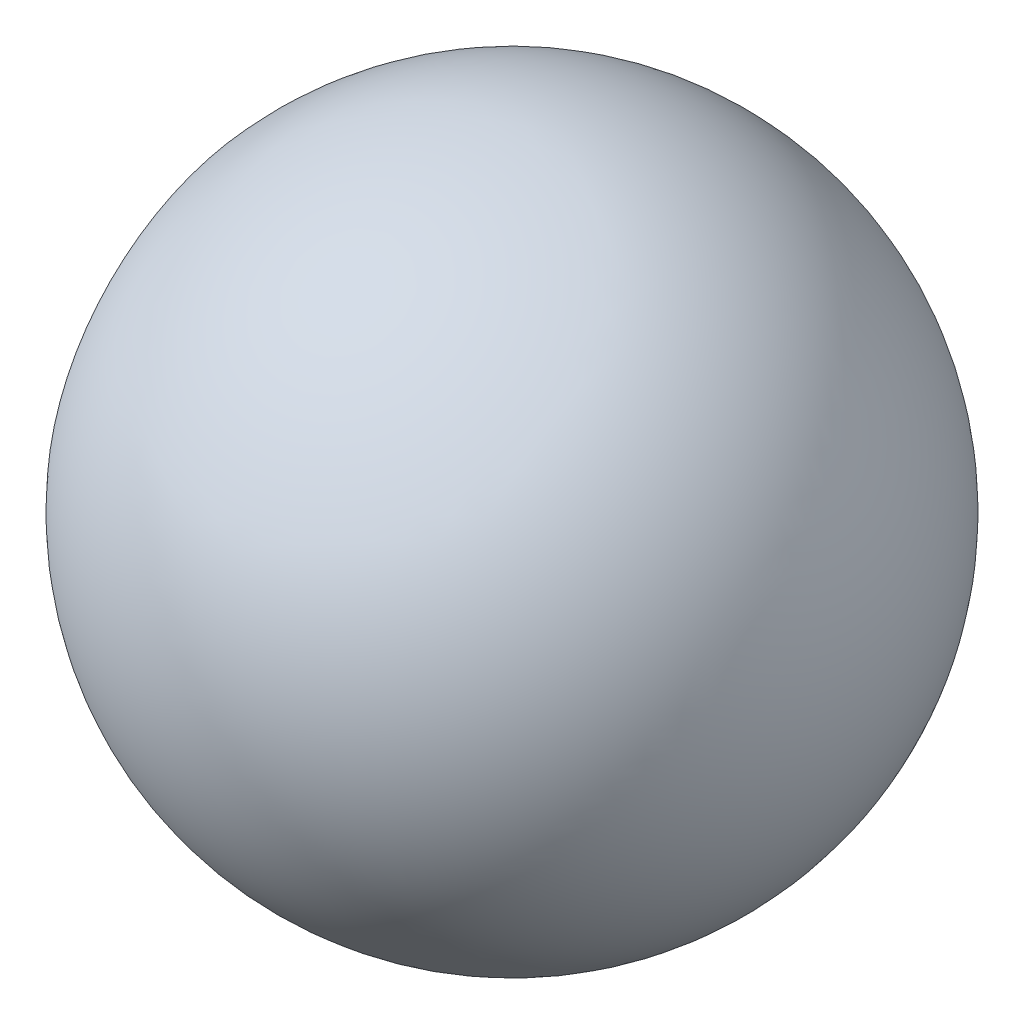
from build123d import *

# Parameters (mm, degrees)
M6_TAPPED_HOLE1_D     = 5
M6_TAPPED_HOLE1_DEPTH = 10
M6_TAPPED_HOLE1_TIP   = 1.502151548


with BuildPart() as part:
    # Sketch1 → Revolve1 (revolve)
    with BuildSketch(Plane.XY, mode=Mode.PRIVATE) as revolve1_sk:
        with BuildLine():
            Line((8, 0), (-6, 0))
            Line((-6, 0), (-6, 5.291502622))
            ThreePointArc((-6, 5.291502622), (2.828427125, 7.483314774), (8, 0))
        make_face()
    revolve(revolve1_sk.sketch.rotate(Axis((8, 0, 0), (-1, 0, 0)), 180), axis=Axis((8, 0, 0), (-1, 0, 0)))

    # M6 Tapped Hole1
    with Locations(Plane.ZY.offset(6)):
        with Locations((0, 0)):
            Hole(M6_TAPPED_HOLE1_D / 2, depth=M6_TAPPED_HOLE1_DEPTH)
            with Locations((0, 0, -(M6_TAPPED_HOLE1_DEPTH + M6_TAPPED_HOLE1_TIP / 2))):  # 118° drill point
                Cone(0, M6_TAPPED_HOLE1_D / 2, M6_TAPPED_HOLE1_TIP, mode=Mode.SUBTRACT)


solid = part.part
